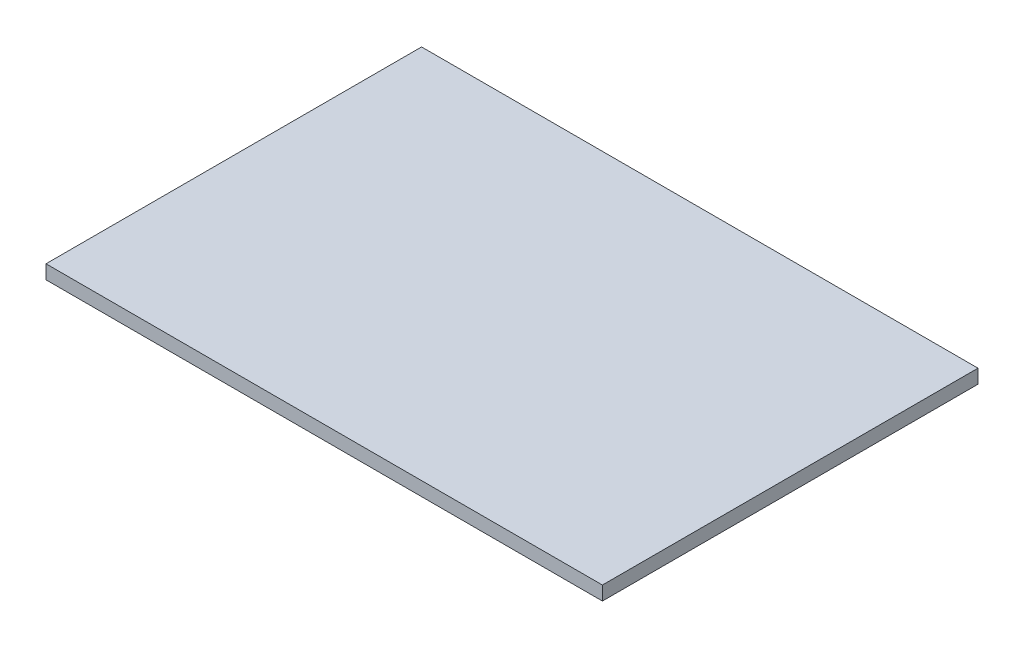
from build123d import *

# Parameters (mm, degrees)
SKETCH1_W           = 40
SKETCH1_H           = 27
BOSS_EXTRUDE1_DEPTH = 1


with BuildPart() as part:
    # Sketch1 → Boss-Extrude1 (new body)
    with BuildSketch(Plane(origin=(0, 0, 0), x_dir=(1, 0, 0), z_dir=(0, 1, 0))):
        with Locations((20, -13.5)):
            Rectangle(SKETCH1_W, SKETCH1_H)
    extrude(amount=BOSS_EXTRUDE1_DEPTH)


solid = part.part
